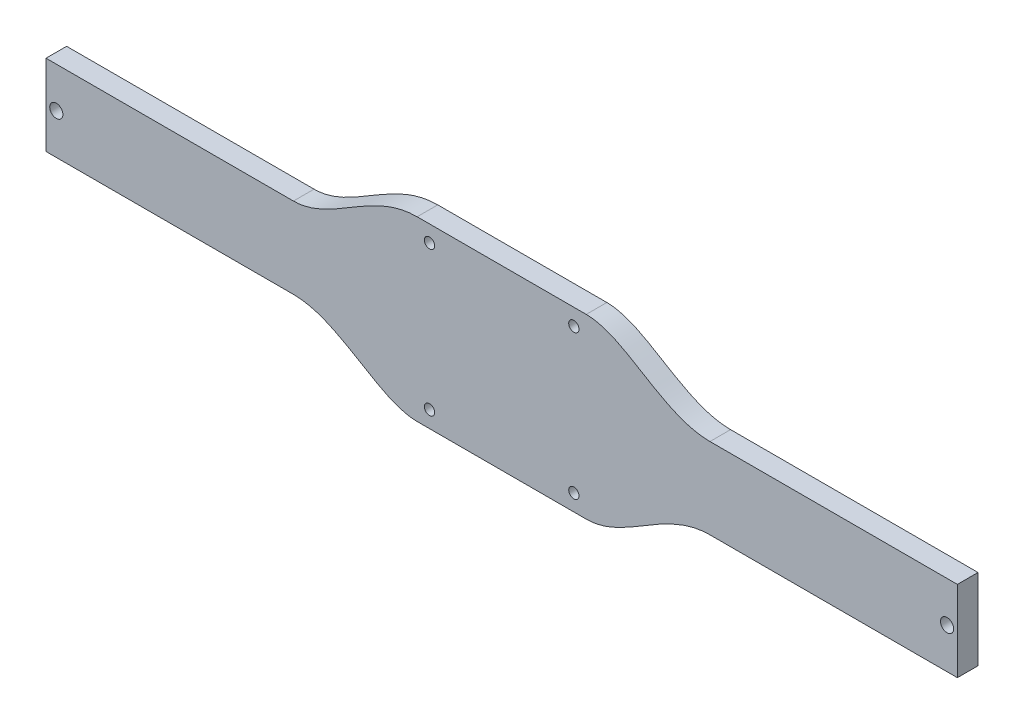
from build123d import *

# Parameters (mm, degrees)
SKETCH1_R      = 1.5875
SKETCH1_R_2    = 2.032
EXTRUDE1_DEPTH = 6.35


with BuildPart() as part:
    # Sketch1 → Extrude1 (new body)
    with BuildSketch(Plane.XY):
        with BuildLine():
            Line((-198.340264606, 29.708721685), (-122.140264606, 29.708721685))
            add(Edge.make_bspline(
                [(-84.040264606, 44.567721685), (-98.359806002, 44.567721685), (-110.19434592, 29.708721685), (-122.140264606, 29.708721685)],
                knots=[0, 0, 0, 0, 1, 1, 1, 1], degree=3))
            Line((-84.040264606, 44.567721685), (-31.970264606, 44.567721685))
            add(Edge.make_bspline(
                [(-31.970264606, 44.567721685), (-19.845994983, 44.567721685), (-8.482470496, 29.708721685), (6.129735394, 29.708721685)],
                knots=[0, 0, 0, 0, 1, 1, 1, 1], degree=3))
            Line((6.129735394, 29.708721685), (82.329735394, 29.708721685))
            Line((82.329735394, 29.708721685), (82.329735394, 4.816721685))
            Line((82.329735394, 4.816721685), (6.129735394, 4.816721685))
            add(Edge.make_bspline(
                [(-31.970264606, -10.042278315), (-19.845994974, -10.042278315), (-8.148130117, 4.816721685), (6.129735394, 4.816721685)],
                knots=[0, 0, 0, 0, 1, 1, 1, 1], degree=3))
            Line((-31.970264606, -10.042278315), (-84.040264606, -10.042278315))
            add(Edge.make_bspline(
                [(-84.040264606, -10.042278315), (-95.986183291, -10.042278315), (-107.820723209, 4.816721685), (-122.140264606, 4.816721685)],
                knots=[0, 0, 0, 0, 1, 1, 1, 1], degree=3))
            Line((-122.140264606, 4.816721685), (-198.340264606, 4.816721685))
            Line((-198.340264606, 4.816721685), (-198.340264606, 29.708721685))
        make_face()
        with Locations((-80.230264606, 39.487721685)):
            Circle(SKETCH1_R, mode=Mode.SUBTRACT)
        with Locations((-35.780264606, 39.487721685)):
            Circle(SKETCH1_R, mode=Mode.SUBTRACT)
        with Locations((-80.230264606, -4.962278315)):
            Circle(SKETCH1_R, mode=Mode.SUBTRACT)
        with Locations((-35.780264606, -4.962278315)):
            Circle(SKETCH1_R, mode=Mode.SUBTRACT)
        with Locations((79.154735394, 17.262721685)):
            Circle(SKETCH1_R_2, mode=Mode.SUBTRACT)
        with Locations(Location((-195.165264606, 17.262721685, 0), (0, 0, 180))):
            Circle(SKETCH1_R_2, mode=Mode.SUBTRACT)
    extrude(amount=EXTRUDE1_DEPTH)


solid = part.part
